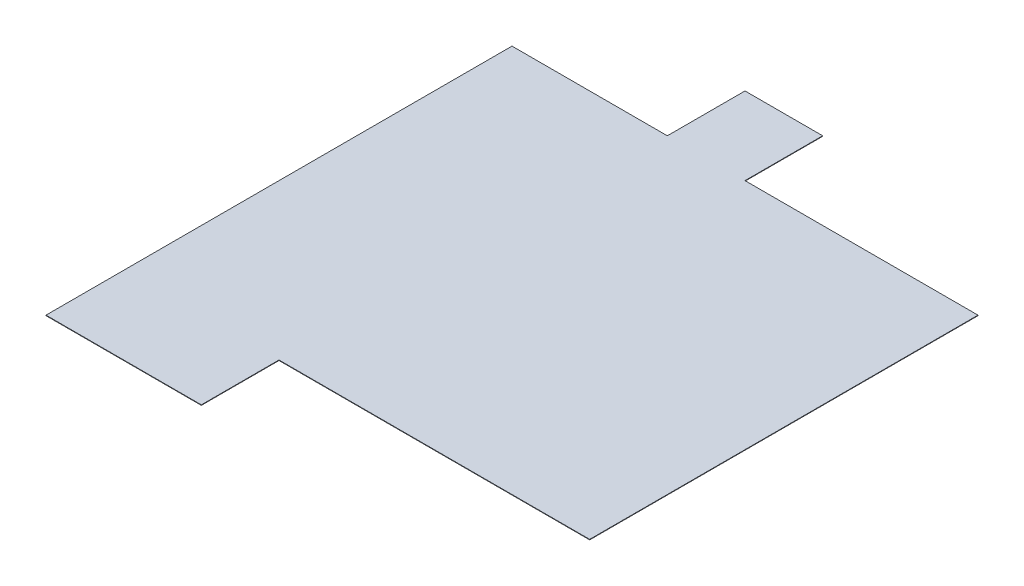
from build123d import *

# Parameters (mm, degrees)
SKETCH_1_W          = 4800
SKETCH_1_H          = 5600
EXTRUDE_1_DEPTH     = 5
CUT_EXTRUDE_2_DEPTH = 5
SKETCH_3_W          = 800
SKETCH_3_H          = 800
EXTRUDE_2_DEPTH     = 5


with BuildPart() as part:
    # 草图1 → 凸台-拉伸1 (new body)
    with BuildSketch(Plane(origin=(0, 0, 0), x_dir=(1, 0, 0), z_dir=(0, 1, 0))):
        Rectangle(SKETCH_1_W, SKETCH_1_H)
    extrude(amount=EXTRUDE_1_DEPTH)

    # 草图2 → 切除-拉伸2 (cut)
    with BuildSketch(Plane(origin=(0, 0, 0), x_dir=(1, 0, 0), z_dir=(0, 1, 0))):
        Polygon((-800, -2800), (2400, -2800), (2400, -1200), (-800, -1200), (-800, -2000), (-2400, -2000), (-2400, -2800), align=None)
    extrude(amount=CUT_EXTRUDE_2_DEPTH, mode=Mode.SUBTRACT)

    # 草图3 → 凸台-拉伸2 (add)
    with BuildSketch(Plane(origin=(0, 0, 0), x_dir=(1, 0, 0), z_dir=(0, 1, 0))):
        with Locations((-400, 3200)):
            Rectangle(SKETCH_3_W, SKETCH_3_H)
    extrude(amount=EXTRUDE_2_DEPTH)


solid = part.part
